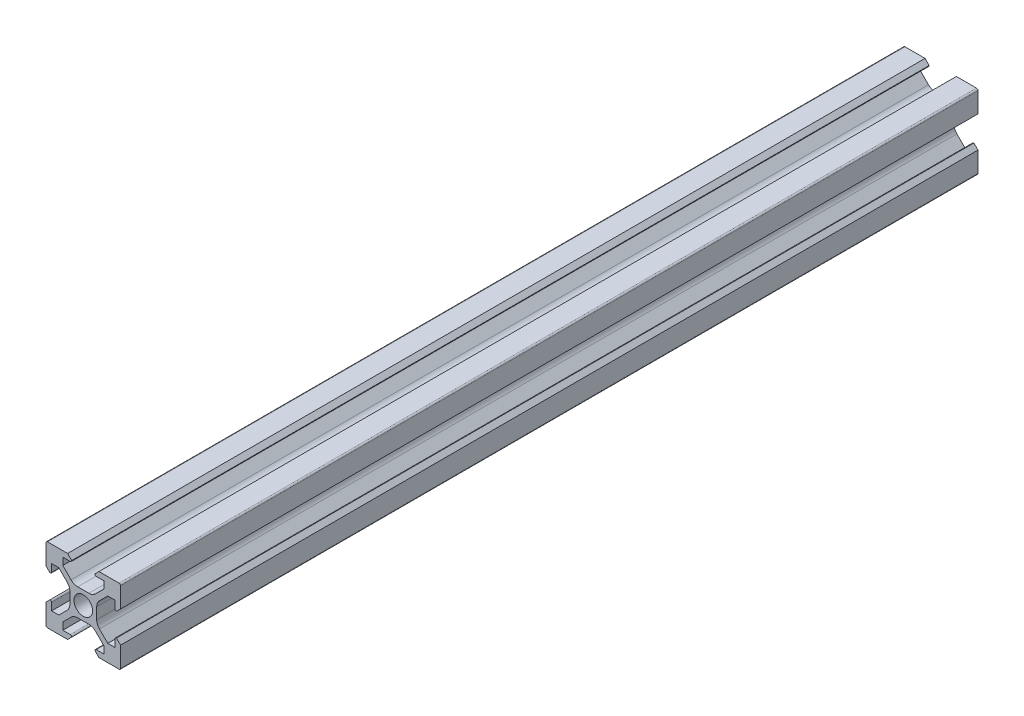
from build123d import *

# Parameters (mm, degrees)
BOSS_EXTRU_1_DEPTH = 230


with BuildPart() as part:
    # Esquisse1 → Boss.-Extru.1 (new body)
    with BuildSketch(Plane.XY):
        with BuildLine():
            Line((-3.1, 8.9), (-4.2, 10))
            Line((-4.2, 10), (-9.6, 10))
            ThreePointArc((-9.6, 10), (-9.882842712, 9.882842712), (-10, 9.6))
            Line((-10, 9.6), (-10, 4.2))
            Line((-10, 4.2), (-8.9, 3.1))
            ThreePointArc((-8.9, 3.1), (-8.617157287, 3.217157287), (-8.5, 3.5))
            Line((-8.5, 3.5), (-8.5, 5.5))
            Line((-8.5, 5.5), (-6.560660172, 5.5))
            Line((-6.560660172, 5.5), (-4.332233047, 3.271572875))
            ThreePointArc((-4.332233047, 3.271572875), (-3.790301169, 2.460514503), (-3.6, 1.503805922))
            Line((-3.6, 1.503805922), (-3.6, 0))
            Line((-3.6, 0), (-3.6, -1.503805922))
            ThreePointArc((-3.6, -1.503805922), (-3.790301169, -2.460514503), (-4.332233047, -3.271572875))
            Line((-4.332233047, -3.271572875), (-6.560660172, -5.5))
            Line((-6.560660172, -5.5), (-8.5, -5.5))
            Line((-8.5, -5.5), (-8.5, -3.5))
            ThreePointArc((-8.5, -3.5), (-8.617157287, -3.217157288), (-8.9, -3.1))
            Line((-8.9, -3.1), (-10, -4.2))
            Line((-10, -4.2), (-10, -9.6))
            ThreePointArc((-10, -9.6), (-9.882842712, -9.882842712), (-9.6, -10))
            Line((-9.6, -10), (-4.2, -10))
            Line((-4.2, -10), (-3.1, -8.9))
            ThreePointArc((-3.1, -8.9), (-3.217157287, -8.617157288), (-3.5, -8.5))
            Line((-3.5, -8.5), (-5.5, -8.5))
            Line((-5.5, -8.5), (-5.5, -6.560660172))
            Line((-5.5, -6.560660172), (-3.271572875, -4.332233047))
            ThreePointArc((-3.271572875, -4.332233047), (-2.460514503, -3.790301169), (-1.503805922, -3.6))
            Line((-1.503805922, -3.6), (1.503805922, -3.6))
            ThreePointArc((1.503805922, -3.6), (2.460514503, -3.790301169), (3.271572875, -4.332233047))
            Line((3.271572875, -4.332233047), (5.5, -6.560660172))
            Line((5.5, -6.560660172), (5.5, -8.5))
            Line((5.5, -8.5), (3.5, -8.5))
            ThreePointArc((3.5, -8.5), (3.217157288, -8.617157288), (3.1, -8.9))
            Line((3.1, -8.9), (4.2, -10))
            Line((4.2, -10), (9.6, -10))
            ThreePointArc((9.6, -10), (9.882842713, -9.882842712), (10, -9.6))
            Line((10, -9.6), (10, -4.2))
            Line((10, -4.2), (8.9, -3.1))
            ThreePointArc((8.9, -3.1), (8.617157288, -3.217157288), (8.5, -3.5))
            Line((8.5, -3.5), (8.5, -5.5))
            Line((8.5, -5.5), (6.560660172, -5.5))
            Line((6.560660172, -5.5), (4.332233047, -3.271572875))
            ThreePointArc((4.332233047, -3.271572875), (3.790301169, -2.460514503), (3.6, -1.503805922))
            Line((3.6, -1.503805922), (3.6, 0))
            Line((3.6, 0), (3.6, 1.503805922))
            ThreePointArc((3.6, 1.503805922), (3.790301169, 2.460514503), (4.332233047, 3.271572875))
            Line((4.332233047, 3.271572875), (6.560660172, 5.5))
            Line((6.560660172, 5.5), (8.5, 5.5))
            Line((8.5, 5.5), (8.5, 3.5))
            ThreePointArc((8.5, 3.5), (8.617157288, 3.217157287), (8.9, 3.1))
            Line((8.9, 3.1), (10, 4.2))
            Line((10, 4.2), (10, 9.6))
            ThreePointArc((10, 9.6), (9.882842713, 9.882842712), (9.6, 10))
            Line((9.6, 10), (4.2, 10))
            Line((4.2, 10), (3.1, 8.9))
            ThreePointArc((3.1, 8.9), (3.217157288, 8.617157287), (3.5, 8.5))
            Line((3.5, 8.5), (5.5, 8.5))
            Line((5.5, 8.5), (5.5, 6.560660172))
            Line((5.5, 6.560660172), (3.271572875, 4.332233047))
            ThreePointArc((3.271572875, 4.332233047), (2.460514503, 3.790301169), (1.503805922, 3.6))
            Line((1.503805922, 3.6), (-1.503805922, 3.6))
            ThreePointArc((-1.503805922, 3.6), (-2.460514503, 3.790301169), (-3.271572875, 4.332233047))
            Line((-3.271572875, 4.332233047), (-5.5, 6.560660172))
            Line((-5.5, 6.560660172), (-5.5, 8.5))
            Line((-5.5, 8.5), (-3.5, 8.5))
            ThreePointArc((-3.5, 8.5), (-3.217157287, 8.617157287), (-3.1, 8.9))
        make_face()
        with BuildLine():
            ThreePointArc((2.5, 0), (0, 2.5), (-2.5, 0))
            ThreePointArc((-2.5, 0), (0, -2.5), (2.5, 0))
        make_face(mode=Mode.SUBTRACT)
    extrude(amount=BOSS_EXTRU_1_DEPTH)


solid = part.part
